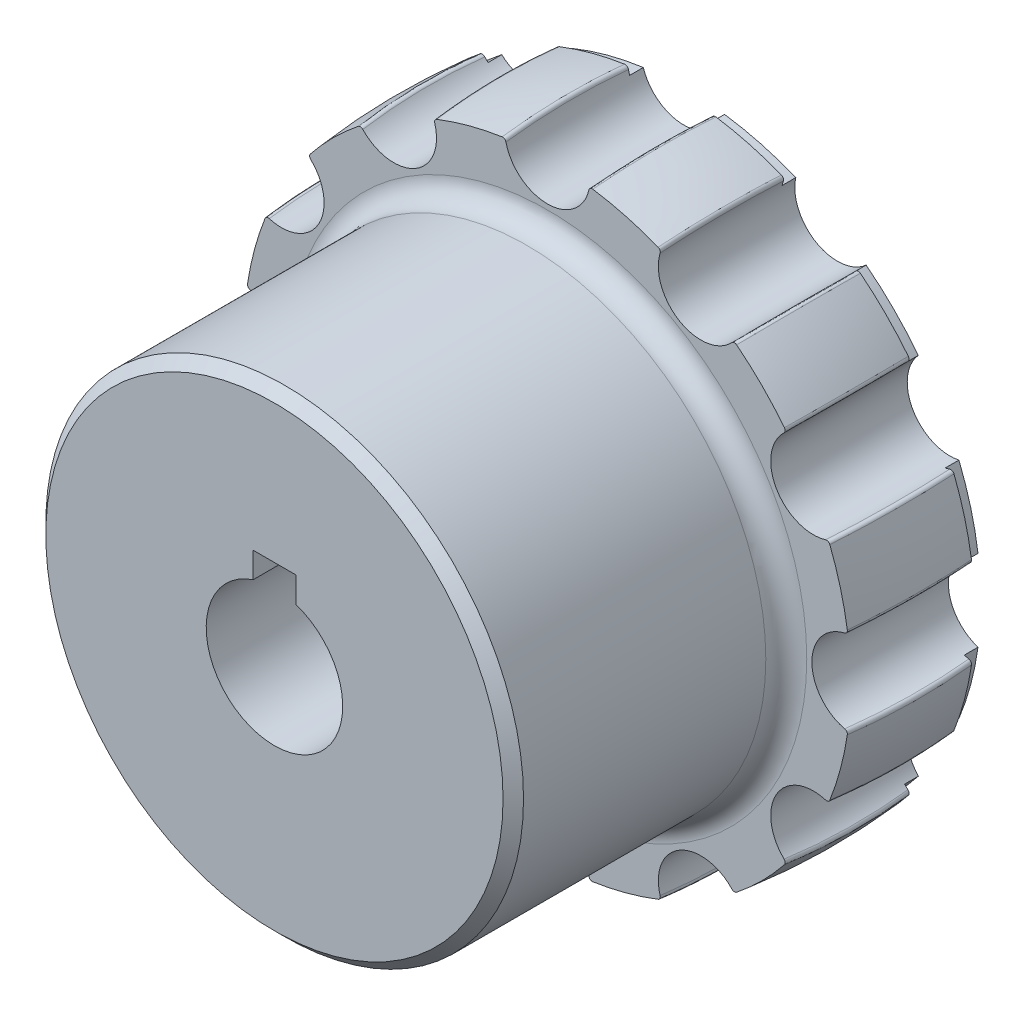
from build123d import *

# Parameters (mm, degrees)
SKETCH_1_R          = 130
EXTRUDE_1_DEPTH     = 40
SKETCH_2_R          = 70
EXTRUDE_2_DEPTH     = 120
SKETCH_4_R          = 12.5
CUT_EXTRUDE_1_DEPTH = 70
FILLET_1_R          = 6
CHAMFER_1_SIZE      = 3
FILLET_2_R          = 1
SCALE_1_SCALE       = 0.2
SKETCH_6_R          = 4
CUT_EXTRUDE_2_DEPTH = 35.779034748
CUT_EXTRUDE_3_DEPTH = 35.779034748


with BuildPart() as part:
    # 草图1 → 凸台-拉伸1 (new body)
    with BuildSketch(Plane.XY):
        Circle(SKETCH_1_R)
    extrude(amount=EXTRUDE_1_DEPTH)

    # 草图2 → 凸台-拉伸2 (add)
    with BuildSketch(Plane.XY):
        Circle(SKETCH_2_R)
    extrude(amount=EXTRUDE_2_DEPTH)

    # 草图3 → 切除-旋转1 (revolve, cut)
    with BuildSketch(Plane(origin=(0, 0, 0), x_dir=(1, 0, 0), z_dir=(0, 1, 0))):
        with BuildLine():
            Line((-87, 0), (-87, -4))
            Line((-87, -4), (-89.287478648, -4))
            ThreePointArc((-89.287478648, -4), (-89.988776291, -22.010076897), (-88.8854382, -40))
            Line((-88.8854382, -40), (-140, -40))
            Line((-140, -40), (-140, 0))
            Line((-140, 0), (-87, 0))
        make_face()
    revolve(axis=Axis((0, 0, -59.373086337), (0, 0, 1)), mode=Mode.SUBTRACT)

    # 草图4 → 切除-拉伸1 (cut)
    with BuildSketch(Plane.XY.offset(40)):
        with Locations((0, 90)):
            Circle(SKETCH_4_R)
        with Locations((45, 77.942286341)):
            Circle(SKETCH_4_R)
        with Locations((77.942286341, 45)):
            Circle(SKETCH_4_R)
        with Locations((90, 0)):
            Circle(SKETCH_4_R)
        with Locations((77.942286341, -45)):
            Circle(SKETCH_4_R)
        with Locations((45, -77.942286341)):
            Circle(SKETCH_4_R)
        with Locations((0, -90)):
            Circle(SKETCH_4_R)
        with Locations((-45, -77.942286341)):
            Circle(SKETCH_4_R)
        with Locations((-77.942286341, -45)):
            Circle(SKETCH_4_R)
        with Locations((-90, 0)):
            Circle(SKETCH_4_R)
        with Locations((-77.942286341, 45)):
            Circle(SKETCH_4_R)
        with Locations((-45, 77.942286341)):
            Circle(SKETCH_4_R)
    extrude(amount=-CUT_EXTRUDE_1_DEPTH, mode=Mode.SUBTRACT)

    # 圆角1
    fillet_1_edges = [part.edges().sort_by_distance(p)[0] for p in [
        (-70, 0, 40),
    ]]
    fillet(fillet_1_edges, radius=FILLET_1_R)

    # 倒角1
    chamfer_1_edges = [part.edges().sort_by_distance(p)[0] for p in [
        (-70, 0, 120),
    ]]
    chamfer(chamfer_1_edges, length=CHAMFER_1_SIZE)

    # 圆角2
    fillet_2_edges = [part.edges().sort_by_distance(p)[0] for p in [
        (12.469036418, -89.120721427, 22.010077717),
        (-12.469036418, -89.120721427, 22.010077717),
        (-33.761858415, -83.415326968, 22.010077717),
        (-55.358863012, -70.94629055, 22.010077717),
        (-70.94629055, -55.358863012, 22.010077717),
        (-83.415326968, -33.761858415, 22.010077717),
        (-89.120721427, -12.469036418, 22.010077717),
        (-89.120721427, 12.469036418, 22.010077717),
        (-83.415326968, 33.761858415, 22.010077717),
        (-70.94629055, 55.358863012, 22.010077717),
        (-55.358863012, 70.94629055, 22.010077717),
        (-33.761858415, 83.415326968, 22.010077717),
        (-12.469036418, 89.120721427, 22.010077717),
        (12.469036418, 89.120721427, 22.010077717),
        (33.761858415, 83.415326968, 22.010077717),
        (55.358863012, 70.94629055, 22.010077717),
        (70.94629055, 55.358863012, 22.010077717),
        (83.415326968, 33.761858415, 22.010077717),
        (89.120721427, 12.469036418, 22.010077717),
        (89.120721427, -12.469036418, 22.010077717),
        (83.415326968, -33.761858415, 22.010077717),
        (70.94629055, -55.358863012, 22.010077717),
        (55.358863012, -70.94629055, 22.010077717),
        (33.761858415, -83.415326968, 22.010077717),
    ]]
    fillet(fillet_2_edges, radius=FILLET_2_R)


with BuildPart() as part_1:
    # 缩放比例1: scaled about (0, 0, 54.648003893)
    add(part.part.scale(SCALE_1_SCALE).moved(Location((0, 0, 43.718403114))))

    # 草图6 → 切除-拉伸2 (cut, through all)
    with BuildSketch(Plane.XY.offset(67.718405763)):
        Circle(SKETCH_6_R)
    extrude(amount=-CUT_EXTRUDE_2_DEPTH, mode=Mode.SUBTRACT)

    # 草图9 → 切除-拉伸3 (cut, through all)
    with BuildSketch(Plane.XY.offset(67.718405763)):
        with BuildLine():
            Line((-1.25, 3.799671038), (-1.25, 5.299671038))
            Line((-1.25, 5.299671038), (1.25, 5.299671038))
            Line((1.25, 5.299671038), (1.25, 3.799671038))
            ThreePointArc((1.25, 3.799671038), (0, 4), (-1.25, 3.799671038))
        make_face()
    extrude(amount=-CUT_EXTRUDE_3_DEPTH, mode=Mode.SUBTRACT)


solid = part_1.part
